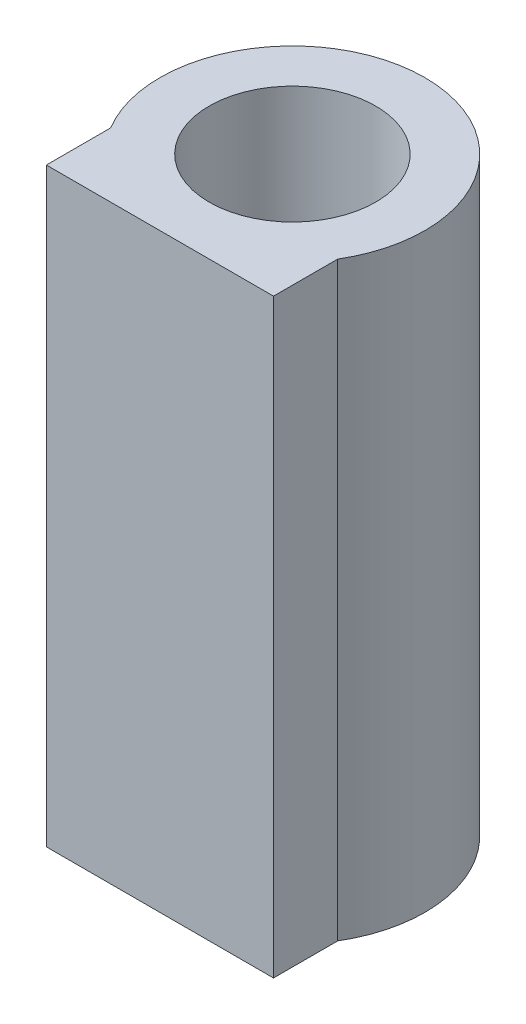
from build123d import *

# Parameters (mm, degrees)
SKETCH1_R           = 1.1
BOSS_EXTRUDE1_DEPTH = 7.8


with BuildPart() as part:
    # Sketch1 → Boss-Extrude1 (new body)
    # profile 1 of 5: a face of its own
    with BuildSketch(Plane(origin=(0, 0, 0), x_dir=(1, 0, 0), z_dir=(0, 1, 0))):
        with BuildLine():
            ThreePointArc((-1.5, -0.901387819), (-0.861705088, -1.523142916), (0, -1.75))
            ThreePointArc((0, -1.75), (0.861705088, -1.523142916), (1.5, -0.901387819))
            Line((1.5, -0.901387819), (1.5, 0.901387819))
            ThreePointArc((1.5, 0.901387819), (0.861705088, 1.523142916), (0, 1.75))
            ThreePointArc((0, 1.75), (-0.861705088, 1.523142916), (-1.5, 0.901387819))
            Line((-1.5, 0.901387819), (-1.5, -0.901387819))
        make_face()
        with Locations(Location((0, 0, 0), (0, 0, 270))):
            Circle(SKETCH1_R, mode=Mode.SUBTRACT)
    # profile 2 of 5: a face of its own
    with BuildSketch(Plane(origin=(0, 0, 0), x_dir=(1, 0, 0), z_dir=(0, 1, 0))):
        with BuildLine():
            ThreePointArc((-1.5, 0.901387819), (-1.75, 0), (-1.5, -0.901387819))
            Line((-1.5, -0.901387819), (-1.5, 0.901387819))
        make_face()
    # profile 3 of 5: a face of its own
    with BuildSketch(Plane(origin=(0, 0, 0), x_dir=(1, 0, 0), z_dir=(0, 1, 0))):
        with BuildLine():
            Line((1.5, 0.901387819), (1.5, -0.901387819))
            ThreePointArc((1.5, -0.901387819), (1.686342195, -0.467707173), (1.75, 0))
            ThreePointArc((1.75, 0), (1.686342195, 0.467707173), (1.5, 0.901387819))
        make_face()
    # profile 4 of 5: a face of its own
    with BuildSketch(Plane(origin=(0, 0, 0), x_dir=(1, 0, 0), z_dir=(0, 1, 0))):
        with BuildLine():
            Line((0, -1.75), (1.5, -1.75))
            Line((1.5, -1.75), (1.5, -0.901387819))
            ThreePointArc((1.5, -0.901387819), (0.861705088, -1.523142916), (0, -1.75))
        make_face()
    # profile 5 of 5: a face of its own
    with BuildSketch(Plane(origin=(0, 0, 0), x_dir=(1, 0, 0), z_dir=(0, 1, 0))):
        with BuildLine():
            Line((-1.5, -1.75), (0, -1.75))
            ThreePointArc((0, -1.75), (-0.861705088, -1.523142916), (-1.5, -0.901387819))
            Line((-1.5, -0.901387819), (-1.5, -1.75))
        make_face()
    extrude(amount=BOSS_EXTRUDE1_DEPTH)


solid = part.part
